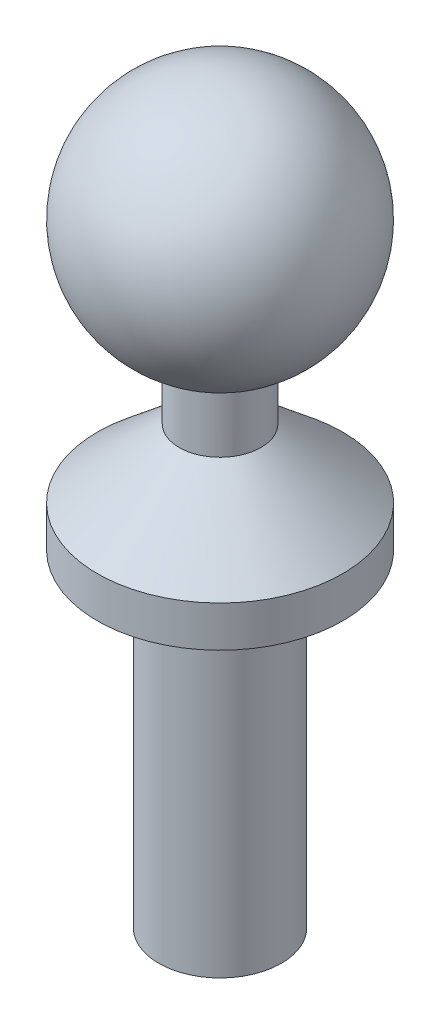
from build123d import *


with BuildPart() as part:
    # Esquisse1 → Révolution2 (revolve)
    with BuildSketch(Plane.XY, mode=Mode.PRIVATE) as r_volution2_sk:
        with BuildLine():
            Line((0, -15), (1.5, -15))
            Line((1.5, -15), (1.5, -7))
            Line((1.5, -7), (3, -7))
            Line((3, -7), (3, -6))
            Line((3, -6), (1, -4.328427125))
            Line((1, -4.328427125), (1, -2.828427125))
            ThreePointArc((1, -2.828427125), (2.956795679, 0.507305936), (0, 3))
            Line((0, 3), (0, -15))
        make_face()
    revolve(r_volution2_sk.sketch.rotate(Axis((0, -15, 0), (0, 1, 0)), 90), axis=Axis((0, -15, 0), (0, 1, 0)))


solid = part.part
